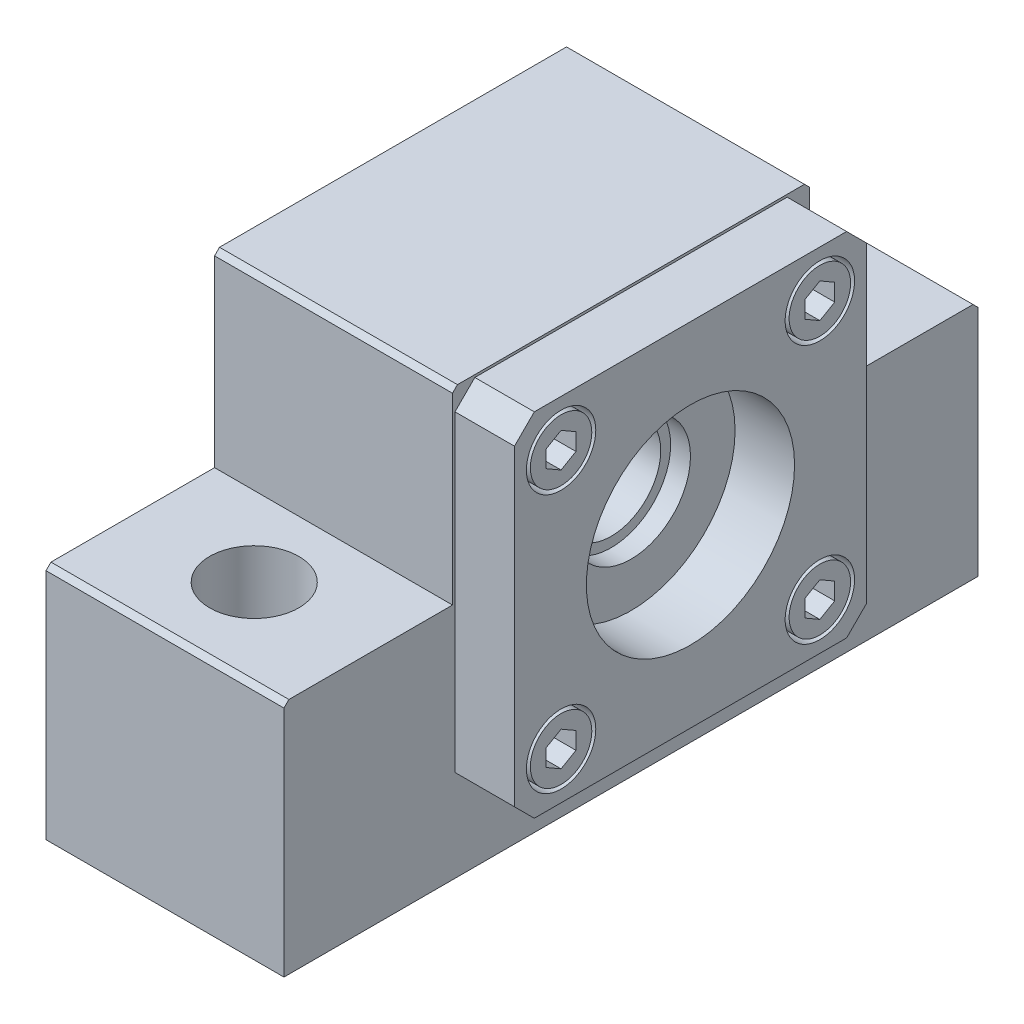
from build123d import *

# Parameters (mm, degrees)
BOSS_EXTRUDE1_DEPTH = 24
SKETCH4_R           = 3.5
BOSS_EXTRUDE2_DEPTH = 6
SKETCH5_R           = 3.1
BOSS_EXTRUDE3_DEPTH = 6
DIAMETERHOLE1_D     = 3
DIAMETERHOLE1_DEPTH = 3
DIAMETERHOLE1_TIP   = 0.901290929
CUT_EXTRUDE1_DEPTH  = 3
DIAMETERHOLE3_D     = 9


with BuildPart() as part:
    # Sketch1 → Boss-Extrude1 (new body)
    with BuildSketch(Plane(origin=(0, 0, 0), x_dir=(0, 0, -1), z_dir=(1, 0, 0))):
        Polygon((-18, 42.5), (-18, 24), (-34.5, 24), (-35, 23.5), (-35, 0), (35, 0), (35, 23.5), (34.5, 24), (18, 24), (18, 42.5), (17.5, 43), (-17.5, 43), align=None)
    extrude(amount=BOSS_EXTRUDE1_DEPTH)

    # Sketch4 → Boss-Extrude2 (add)
    with BuildSketch(Plane(origin=(24, 0, 0), x_dir=(0, 0, -1), z_dir=(1, 0, 0))):
        Polygon((-17.75, 40.75), (-15.75, 42.75), (15.75, 42.75), (17.75, 40.75), (17.75, 9.25), (15.75, 7.25), (-15.75, 7.25), (-17.75, 9.25), align=None)
        with Locations((-13.05, 38.05)):
            Circle(SKETCH4_R, mode=Mode.SUBTRACT)
        with Locations((13.05, 38.05)):
            Circle(SKETCH4_R, mode=Mode.SUBTRACT)
        with Locations((-13.05, 11.95)):
            Circle(SKETCH4_R, mode=Mode.SUBTRACT)
        with Locations((13.05, 11.95)):
            Circle(SKETCH4_R, mode=Mode.SUBTRACT)
    extrude(amount=BOSS_EXTRUDE2_DEPTH)

    # Sketch5 → Boss-Extrude3 (add)
    with BuildSketch(Plane(origin=(24, 0, 0), x_dir=(0, 0, -1), z_dir=(1, 0, 0))):
        with Locations((-13.05, 38.05)):
            Circle(SKETCH5_R)
        with Locations((13.05, 38.05)):
            Circle(SKETCH5_R)
        with Locations((13.05, 11.95)):
            Circle(SKETCH5_R)
        with Locations((-13.05, 11.95)):
            Circle(SKETCH5_R)
    extrude(amount=BOSS_EXTRUDE3_DEPTH)

    # DiameterHole1
    with Locations(Plane(origin=(30, 0, 0), x_dir=(0, 0, -1), z_dir=(1, 0, 0))):
        with Locations((-13.05, 38.05), (13.05, 38.05), (-13.05, 11.95), (13.05, 11.95)):
            Hole(DIAMETERHOLE1_D / 2, depth=DIAMETERHOLE1_DEPTH)
            with Locations((0, 0, -(DIAMETERHOLE1_DEPTH + DIAMETERHOLE1_TIP / 2))):  # 118° drill point
                Cone(0, DIAMETERHOLE1_D / 2, DIAMETERHOLE1_TIP, mode=Mode.SUBTRACT)

    # Sketch8 → Cut-Extrude1 (cut)
    with BuildSketch(Plane(origin=(30, 0, 0), x_dir=(0, 0, -1), z_dir=(1, 0, 0))):
        Polygon((-13.05, 36.317949192), (-11.55, 37.183974596), (-11.55, 38.916025404), (-13.05, 39.782050808), (-14.55, 38.916025404), (-14.55, 37.183974596), align=None)
        Polygon((14.55, 37.183974596), (14.55, 38.916025404), (13.05, 39.782050808), (11.55, 38.916025404), (11.55, 37.183974596), (13.05, 36.317949192), align=None)
        Polygon((-11.55, 11.083974596), (-11.55, 12.816025404), (-13.05, 13.682050808), (-14.55, 12.816025404), (-14.55, 11.083974596), (-13.05, 10.217949192), align=None)
        Polygon((14.55, 11.083974596), (14.55, 12.816025404), (13.05, 13.682050808), (11.55, 12.816025404), (11.55, 11.083974596), (13.05, 10.217949192), align=None)
    extrude(amount=-CUT_EXTRUDE1_DEPTH, mode=Mode.SUBTRACT)

    # Sketch9 → Cut-Revolve1 (revolve, cut)
    with BuildSketch(Plane.XY):
        Polygon((0, 35.5), (3, 35.5), (3, 31), (6, 31), (6, 30), (22, 30), (22, 31), (24, 31), (24, 35.5), (30, 35.5), (30, 25), (0, 25), align=None)
    revolve(axis=Axis((30, 25, 0), (-1, 0, 0)), mode=Mode.SUBTRACT)

    # DiameterHole3 (through all)
    with Locations(Plane(origin=(0, 24, 0), x_dir=(1, 0, 0), z_dir=(0, 1, 0))):
        with Locations((12, -26), (12, 26)):
            Hole(DIAMETERHOLE3_D / 2)


solid = part.part
